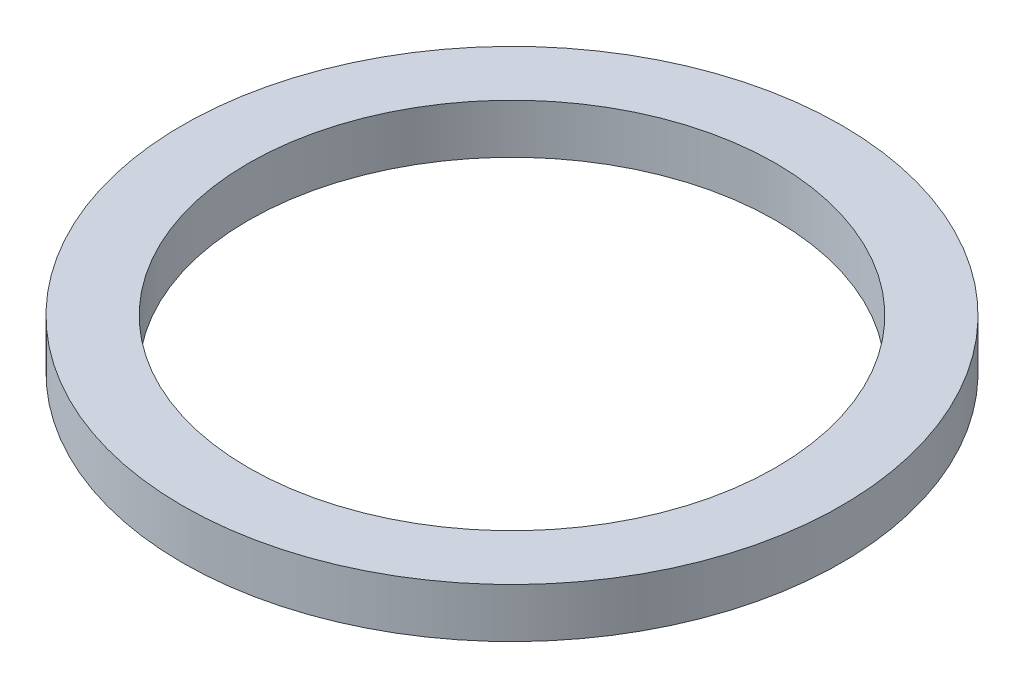
from build123d import *

# Parameters (mm, degrees)
SKETCH1_W = 2
SKETCH1_H = 1.5


with BuildPart() as part:
    # Sketch1 → Revolve1 (revolve)
    with BuildSketch(Plane.XY, mode=Mode.PRIVATE) as revolve1_sk:
        with Locations((-9, 0)):
            Rectangle(SKETCH1_W, SKETCH1_H)
    revolve(revolve1_sk.sketch.rotate(Axis((0, 0, 0), (0, 1, 0)), 270), axis=Axis((0, 0, 0), (0, 1, 0)))


solid = part.part
